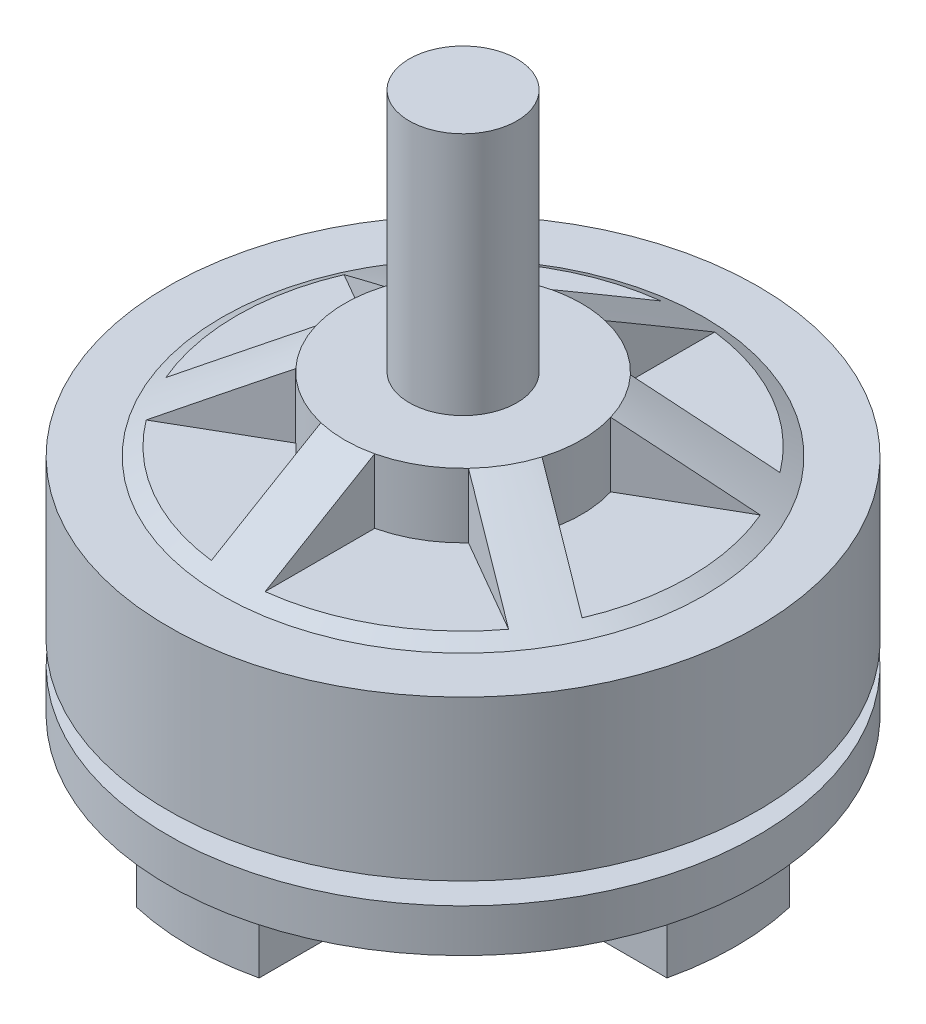
from build123d import *

# Parameters (mm, degrees)
CORTAR_EXTRUIR1_START = -3
CROQUIS2_R            = 3.75
CROQUIS2_R_2          = 1.25
CORTAR_EXTRUIR1_DEPTH = 3
CORTAR_EXTRUIR2_DEPTH = 3


with BuildPart() as part:
    # Croquis1 → Revolución1 (revolve)
    with BuildSketch(Plane.XY, mode=Mode.PRIVATE) as revoluci_n1_sk:
        Polygon((0, 0), (-12.65, 0), (-12.65, 3), (-13.7, 3), (-13.7, 5), (0, 5), align=None)
        Polygon((0, 28.147269), (0, 6), (-13.7, 6), (-13.7, 13.4), (-11.2, 13.4), (-5.5, 16.807269), (-2.5, 16.807269), (-2.5, 28.147269), align=None)
    revolve(revoluci_n1_sk.sketch.rotate(Axis((0, 0, 0), (0, 1, 0)), 270), axis=Axis((0, 0, 0), (0, 1, 0)))

    # Croquis2 → Cortar-Extruir1 (cut)
    with BuildSketch(Plane.XZ.offset(CORTAR_EXTRUIR1_START)):
        with BuildLine():
            ThreePointArc((-2.85, -7.85), (-4.314466094, -4.314466094), (-7.85, -2.85))
            Line((-7.85, -2.85), (-12.324771803, -2.85))
            ThreePointArc((-12.324771803, -2.85), (-8.944900782, -8.944900782), (-2.85, -12.324771803))
            Line((-2.85, -12.324771803), (-2.85, -7.85))
        make_face()
        with BuildLine():
            ThreePointArc((-2.85, 12.324771803), (-8.944900782, 8.944900782), (-12.324771803, 2.85))
            Line((-12.324771803, 2.85), (-7.85, 2.85))
            ThreePointArc((-7.85, 2.85), (-4.314466094, 4.314466094), (-2.85, 7.85))
            Line((-2.85, 7.85), (-2.85, 12.324771803))
        make_face()
        with BuildLine():
            ThreePointArc((12.324771803, 2.85), (8.944900782, 8.944900782), (2.85, 12.324771803))
            Line((2.85, 12.324771803), (2.85, 7.85))
            ThreePointArc((2.85, 7.85), (4.314466094, 4.314466094), (7.85, 2.85))
            Line((7.85, 2.85), (12.324771803, 2.85))
        make_face()
        with BuildLine():
            Line((2.85, -7.85), (2.85, -12.324771803))
            ThreePointArc((2.85, -12.324771803), (8.944900782, -8.944900782), (12.324771803, -2.85))
            Line((12.324771803, -2.85), (7.85, -2.85))
            ThreePointArc((7.85, -2.85), (4.314466094, -4.314466094), (2.85, -7.85))
        make_face()
        with Locations(Location((0, 0, 0), (0, 0, 270))):
            Circle(CROQUIS2_R)
        with Locations(Location((0, -7.9, 0), (0, 0, 270))):
            Circle(CROQUIS2_R_2)
        with Locations(Location((7.9, 0, 0), (0, 0, 270))):
            Circle(CROQUIS2_R_2)
        with Locations(Location((0, 7.9, 0), (0, 0, 270))):
            Circle(CROQUIS2_R_2)
        with Locations(Location((-7.9, 0, 0), (0, 0, 270))):
            Circle(CROQUIS2_R_2)
    extrude(amount=CORTAR_EXTRUIR1_DEPTH, mode=Mode.SUBTRACT)

    # Croquis3 → Cortar-Extruir2 (cut)
    with BuildSketch(Plane(origin=(0, 16.807269, 0), x_dir=(1, 0, 0), z_dir=(0, 1, 0))):
        with BuildLine():
            ThreePointArc((-5.263493829, -1.595503906), (-5.5, 0), (-5.263493829, 1.595503906))
            Line((-5.263493829, 1.595503906), (-10.263886087, 4.482481722))
            ThreePointArc((-10.263886087, 4.482481722), (-11.2, 0), (-10.263886087, -4.482481722))
            Line((-10.263886087, -4.482481722), (-5.263493829, -1.595503906))
        make_face()
        with BuildLine():
            ThreePointArc((-1.25, 11.130026954), (-5.6, 9.699484522), (-9.013886087, 6.647545232))
            Line((-9.013886087, 6.647545232), (-4.013493829, 3.760567415))
            ThreePointArc((-4.013493829, 3.760567415), (-2.75, 4.763139721), (-1.25, 5.356071321))
            Line((-1.25, 5.356071321), (-1.25, 11.130026954))
        make_face()
        with BuildLine():
            Line((1.25, 11.130026954), (1.25, 5.356071321))
            ThreePointArc((1.25, 5.356071321), (2.75, 4.763139721), (4.013493829, 3.760567415))
            Line((4.013493829, 3.760567415), (9.013886087, 6.647545232))
            ThreePointArc((9.013886087, 6.647545232), (5.6, 9.699484522), (1.25, 11.130026954))
        make_face()
        with BuildLine():
            Line((10.263886087, 4.482481722), (5.263493829, 1.595503906))
            ThreePointArc((5.263493829, 1.595503906), (5.440552181, 0.806468828), (5.5, 0))
            ThreePointArc((5.5, 0), (5.440552181, -0.806468828), (5.263493829, -1.595503906))
            Line((5.263493829, -1.595503906), (10.263886087, -4.482481722))
            ThreePointArc((10.263886087, -4.482481722), (11.2, 0), (10.263886087, 4.482481722))
        make_face()
        with BuildLine():
            ThreePointArc((4.013493829, -3.760567415), (2.75, -4.763139721), (1.25, -5.356071321))
            Line((1.25, -5.356071321), (1.25, -11.130026954))
            ThreePointArc((1.25, -11.130026954), (5.6, -9.699484522), (9.013886087, -6.647545232))
            Line((9.013886087, -6.647545232), (4.013493829, -3.760567415))
        make_face()
        with BuildLine():
            ThreePointArc((-1.25, -5.356071321), (-2.75, -4.763139721), (-4.013493829, -3.760567415))
            Line((-4.013493829, -3.760567415), (-9.013886087, -6.647545232))
            ThreePointArc((-9.013886087, -6.647545232), (-5.6, -9.699484522), (-1.25, -11.130026954))
            Line((-1.25, -11.130026954), (-1.25, -5.356071321))
        make_face()
    extrude(amount=-CORTAR_EXTRUIR2_DEPTH, mode=Mode.SUBTRACT)


solid = part.part
